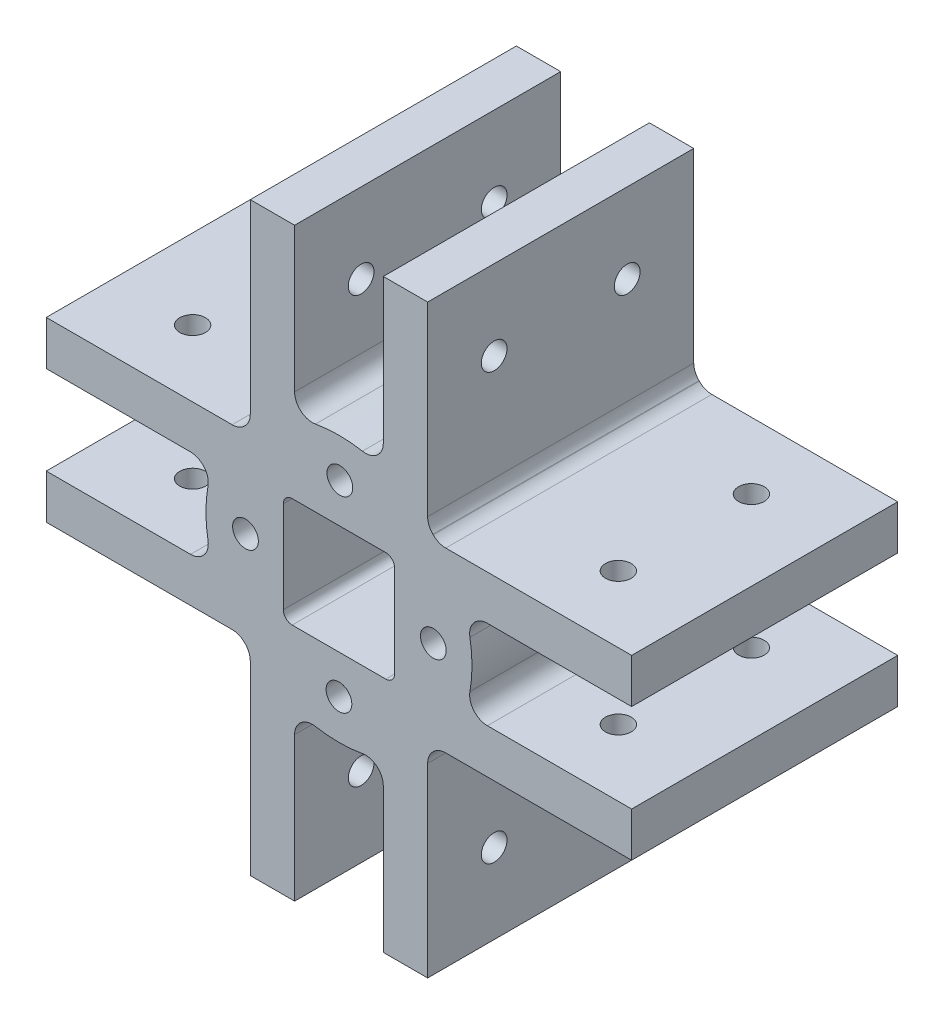
from build123d import *

# Parameters (mm, degrees)
SKETCH1_R                = 15
BOSS_EXTRUDE1_DEPTH      = 15
SKETCH4_W                = 5
SKETCH4_H                = 33
BOSS_EXTRUDE3_DEPTH      = 30
FILLET2_R                = 2
CIRPATTERN7_COUNT        = 4
FILLET2_OF_CIRPATTERN7_R = 2
SKETCH7_R                = 1.45
CUT_EXTRUDE2_DEPTH       = 27
CIRPATTERN9_COUNT        = 4
CUT_EXTRUDE3_REACH       = 57.48
SKETCH8_W                = 12.55
SKETCH8_H                = 12.35
SKETCH9_R                = 1.45
CUT_EXTRUDE4_DEPTH       = 10
FILLET1_R                = 1


with BuildPart() as part:
    # Sketch1 → Boss-Extrude1 (new, symmetric)
    with BuildSketch(Plane.XY):
        Circle(SKETCH1_R)
    extrude(amount=BOSS_EXTRUDE1_DEPTH, both=True)

    # Sketch4 → Boss-Extrude3 (add)
    with BuildSketch(Plane.XY.offset(15)):
        with Locations((-7.5, 16.5)):
            Rectangle(SKETCH4_W, SKETCH4_H)
        with Locations((7.5, 16.5)):
            Rectangle(SKETCH4_W, SKETCH4_H)
    boss_extrude3 = extrude(amount=-BOSS_EXTRUDE3_DEPTH)

    # Fillet2
    fillet2_edges = [part.edges().sort_by_distance(p)[0] for p in [
        (-10, 11.180339887, 0),
        (-5, 14.142135624, 0),
        (10, 11.180339887, 0),
        (5, 14.142135624, 0),
    ]]
    fillet(fillet2_edges, radius=FILLET2_R)

    # CirPattern7: Boss-Extrude3 ×4 about axis
    cirpattern7_axis = Axis((0, 0, 0), (0, 0, 1))
    for i in range(1, CIRPATTERN7_COUNT):
        add(boss_extrude3.rotate(cirpattern7_axis, i * 360 / CIRPATTERN7_COUNT))

    # Fillet2 of CirPattern7
    fillet2_of_cirpattern7_edges = [part.edges().sort_by_distance(p)[0] for p in [
        (-11.180339887, -10, 0),
        (-14.142135624, -5, 0),
        (-11.180339887, 10, 0),
        (-14.142135624, 5, 0),
        (10, -11.180339887, 0),
        (5, -14.142135624, 0),
        (-10, -11.180339887, 0),
        (-5, -14.142135624, 0),
        (11.180339887, 10, 0),
        (14.142135624, 5, 0),
        (11.180339887, -10, 0),
        (14.142135624, -5, 0),
    ]]
    fillet(fillet2_of_cirpattern7_edges, radius=FILLET2_OF_CIRPATTERN7_R)

    # Sketch7 → Cut-Extrude2 (cut)
    with BuildSketch(Plane.ZY.offset(10)):
        with Locations((-7.5, 24)):
            Circle(SKETCH7_R)
        with Locations((7.5, 24)):
            Circle(SKETCH7_R)
        with Locations((22.5, 24)):
            Circle(SKETCH7_R)
        with Locations((37.5, 24)):
            Circle(SKETCH7_R)
        with Locations((52.5, 24)):
            Circle(SKETCH7_R)
    cut_extrude2 = extrude(amount=-CUT_EXTRUDE2_DEPTH, mode=Mode.SUBTRACT)

    # CirPattern9: Cut-Extrude2 ×4 about axis
    cirpattern9_axis = Axis((0, 0, 0), (0, 0, 1))
    for i in range(1, CIRPATTERN9_COUNT):
        add(cut_extrude2.rotate(cirpattern9_axis, i * 360 / CIRPATTERN9_COUNT), mode=Mode.SUBTRACT)

    # Sketch8 → Cut-Extrude3 (cut, up to next)
    with BuildSketch(Plane.XY.offset(15), mode=Mode.PRIVATE) as cut_extrude3_sk1:
        Rectangle(SKETCH8_W, SKETCH8_H)
    cut_extrude3_tool1 = extrude(cut_extrude3_sk1.sketch, amount=-CUT_EXTRUDE3_REACH, mode=Mode.PRIVATE) & part.part
    add(cut_extrude3_tool1.solids().sort_by_distance((0, 0, 15))[0], mode=Mode.SUBTRACT)

    # Sketch9 → Cut-Extrude4 (cut)
    with BuildSketch(Plane.XY.offset(15)):
        with Locations((10.6375, 0)):
            Circle(SKETCH9_R)
        with Locations((0, -10.5375)):
            Circle(SKETCH9_R)
        with Locations((-10.5375, 0.1)):
            Circle(SKETCH9_R)
        with Locations((0.1, 10.6375)):
            Circle(SKETCH9_R)
    cut_extrude4 = extrude(amount=-CUT_EXTRUDE4_DEPTH, mode=Mode.SUBTRACT)

    # Fillet1
    fillet1_edges = [part.edges().sort_by_distance(p)[0] for p in [
        (6.275, 6.175, 0),
        (6.275, -6.175, 0),
        (-6.275, -6.175, 0),
        (-6.275, 6.175, 0),
    ]]
    fillet(fillet1_edges, radius=FILLET1_R)

    # Mirror1: Cut-Extrude4 across plane
    add(cut_extrude4.mirror(Plane.XY), mode=Mode.SUBTRACT)


solid = part.part
